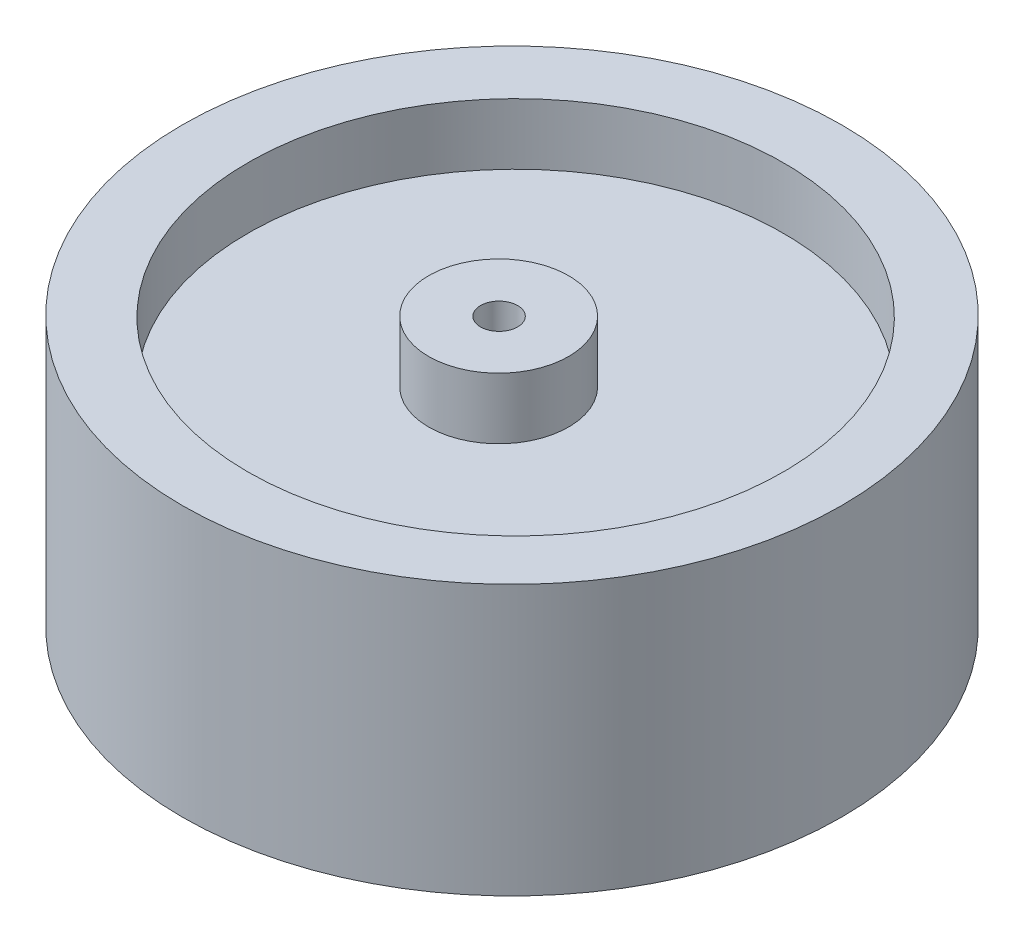
from build123d import *

# Parameters (mm, degrees)
SKETCH1_R                = 32.5
BOSS_EXTRUDE1_DEPTH      = 26.6
SKETCH2_R                = 26.4
CUT_EXTRUDE1_DEPTH       = 6.026
SKETCH5_R                = 25.9
CUT_EXTRUDE2_DEPTH       = 15.932
BOSS_EXTRUDE2_DEPTH      = 6.026
BOSS_EXTRUDE2_DEPTH_BACK = 20.828
SKETCH6_R                = 6.9
CUT_EXTRUDE3_DEPTH       = 13.462
CUT_EXTRUDE3_DEPTH_BACK  = 49.714
SKETCH7_R                = 1.83


with BuildPart() as part:
    # Sketch1 → Boss-Extrude1 (new body)
    with BuildSketch(Plane(origin=(0, 0, 0), x_dir=(1, 0, 0), z_dir=(0, 1, 0))):
        with Locations(Location((3.189451159, 0, 0), (0, 0, 270))):
            Circle(SKETCH1_R)
    extrude(amount=BOSS_EXTRUDE1_DEPTH)

    # Sketch2 → Cut-Extrude1 (cut)
    with BuildSketch(Plane(origin=(0, 26.6, 0), x_dir=(1, 0, 0), z_dir=(0, 1, 0))):
        with Locations(Location((3.547856728, 0, 0), (0, 0, 270))):
            Circle(SKETCH2_R)
    extrude(amount=-CUT_EXTRUDE1_DEPTH, mode=Mode.SUBTRACT)

    # Sketch5 → Cut-Extrude2 (cut)
    with BuildSketch(Plane.XZ):
        with Locations(Location((2.920646982, 0, 0), (0, 0, 270))):
            Circle(SKETCH5_R)
    extrude(amount=-CUT_EXTRUDE2_DEPTH, mode=Mode.SUBTRACT)

    # Sketch6 → Boss-Extrude2 (add, two sides: drawn at the far end of the back side and taken through both)
    with BuildSketch(Plane(origin=(0, 20.574, 0), x_dir=(1, 0, 0), z_dir=(0, 1, 0)).offset(-BOSS_EXTRUDE2_DEPTH_BACK)):
        with Locations(Location((2.605158488, -0.732268174, 0), (0, 0, 270))):
            Circle(SKETCH6_R)
    extrude(amount=BOSS_EXTRUDE2_DEPTH + BOSS_EXTRUDE2_DEPTH_BACK)

    # Sketch7 → Cut-Extrude3 (cut, two sides: drawn at the far end of the back side and taken through both)
    with BuildSketch(Plane(origin=(0, 26.6, 0), x_dir=(1, 0, 0), z_dir=(0, 1, 0)).offset(-CUT_EXTRUDE3_DEPTH_BACK)):
        with Locations(Location((2.641417448, -0.724168536, 0), (0, 0, 270))):
            Circle(SKETCH7_R)
    extrude(amount=CUT_EXTRUDE3_DEPTH + CUT_EXTRUDE3_DEPTH_BACK, mode=Mode.SUBTRACT)


solid = part.part
